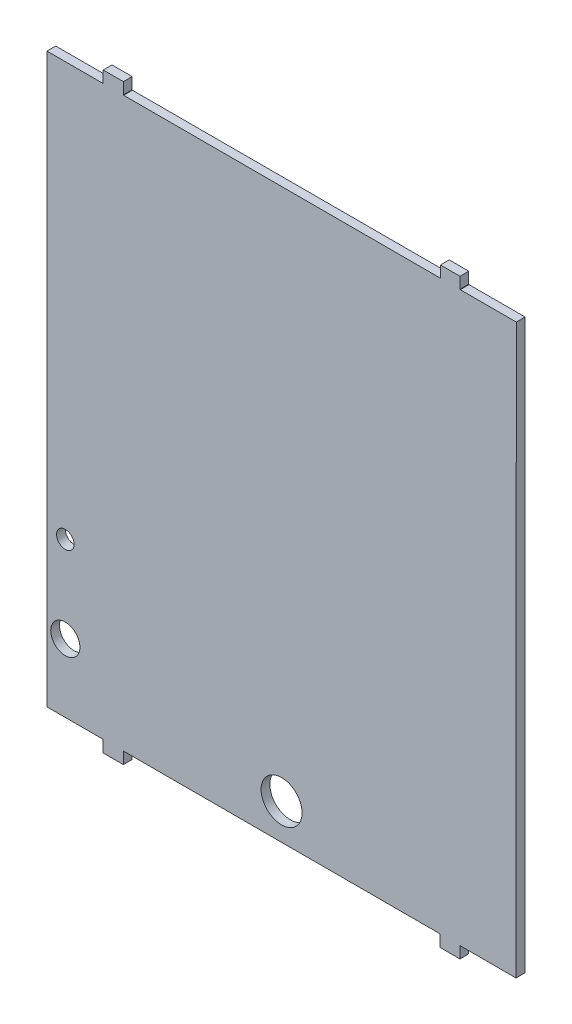
from build123d import *

# Parameters (mm, degrees)
MODEL_R             = 35.6997
MODEL_R_2           = 25.4
MODEL_R_3           = 15.24
BOSS_EXTRUDE2_DEPTH = 15.24
SCALE1_SCALE        = 0.1


with BuildPart() as part:
    # Model → Boss-Extrude2 (new body)
    with BuildSketch(Plane.XY):
        Polygon((683.6156, 410.2862), (683.133, 409.8036), (683.133, 389.7376), (648.0048, 389.7376), (648.0048, 409.702), (647.4968, 410.2862), (550.0116, 410.2862), (550.0116, 1399.2352), (647.4968, 1399.2352), (648.0048, 1399.7432), (648.0048, 1419.7076), (683.133, 1419.7076), (683.133, 1399.8448), (683.641, 1399.3368), (1234.7448, 1399.3368), (1235.202, 1399.8448), (1235.202, 1419.3012), (1269.238, 1419.3012), (1269.238, 1399.7432), (1269.7206, 1399.2352), (1367.3074, 1399.2352), (1366.8248, 409.829), (1269.238, 409.9052), (1269.238, 409.8036), (1269.238, 389.7376), (1234.0844, 389.7376), (1234.0844, 409.8036), (1233.5764, 410.2862), align=None)
        with Locations(Location((958.6214, 472.313, 0), (0, 0, 180))):
            Circle(MODEL_R, mode=Mode.SUBTRACT)
        with Locations(Location((582.0156, 528.8026, 0), (0, 0, 180))):
            Circle(MODEL_R_2, mode=Mode.SUBTRACT)
        with Locations(Location((582.0156, 678.815, 0), (0, 0, 180))):
            Circle(MODEL_R_3, mode=Mode.SUBTRACT)
    extrude(amount=BOSS_EXTRUDE2_DEPTH)


with BuildPart() as part_1:
    # Scale1: scaled about (959.835155039, 908.097861416, 7.62)
    add(part.part.scale(SCALE1_SCALE).moved(Location((863.851639535, 817.288075274, 6.858))))


solid = part_1.part
